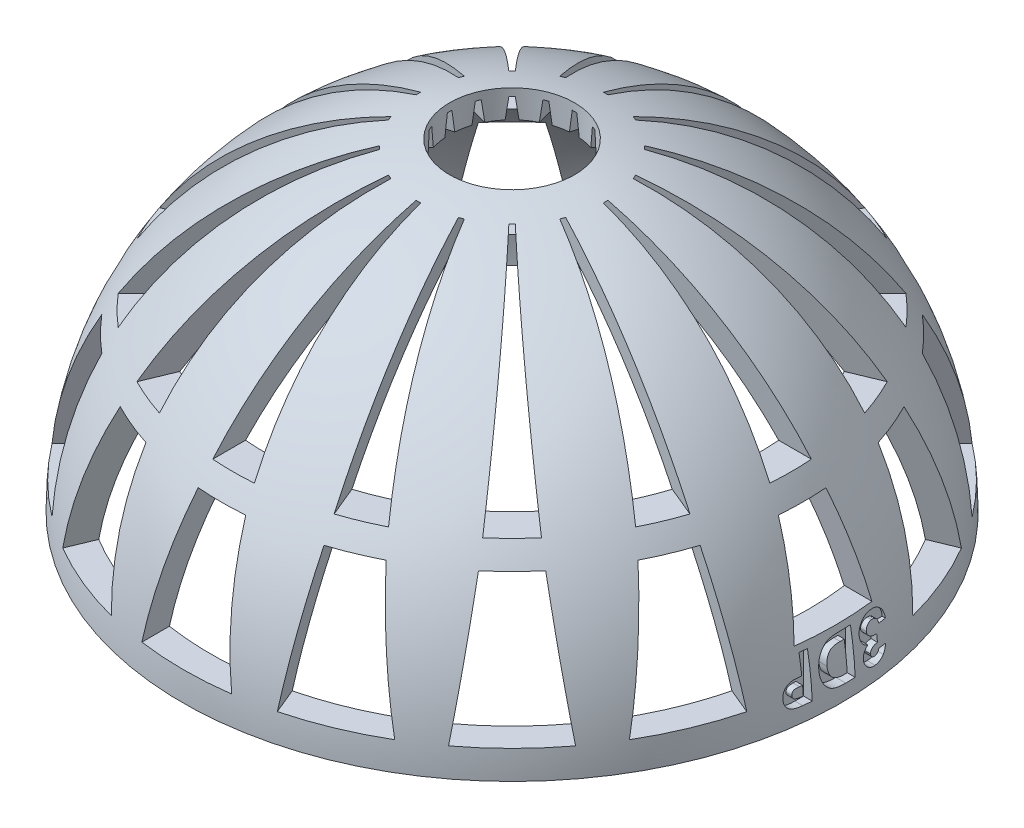
from build123d import *

# Parameters (mm, degrees)
CUT_EXTRUDE1_DEPTH       = 48.5
CIRPATTERN1_COUNT        = 16
SKETCH9_R                = 9.193530205
CUT_EXTRUDE2_DEPTH       = 13.5
REVOLVE3_ANGLE           = 10
REVOLVE3_OTHER_WAY_ANGLE = 10
CUT_EXTRUDE3_DEPTH       = 3.5


with BuildPart() as part:
    # Sketch7 → Revolve2 (revolve)
    with BuildSketch(Plane.XY):
        with BuildLine():
            Line((44.5, 0), (48.5, 0))
            ThreePointArc((48.5, 0), (34.294678888, 34.294678888), (0, 48.5))
            Line((0, 48.5), (0, 44.5))
            ThreePointArc((0, 44.5), (31.466251763, 31.466251763), (44.5, 0))
        make_face()
    revolve(axis=Axis((0, 0, 0), (0, 1, 0)))

    # Sketch8 → Cut-Extrude1 (cut)
    with BuildSketch(Plane(origin=(50.5, 0, 0), x_dir=(0, 0, -1), z_dir=(1, 0, 0))):
        Polygon((-3.5, 22.75), (-6.611443727, 4.095480906), (6.611443727, 4.095480906), (3.5, 22.75), align=None)
        Polygon((-3.060333396, 25.75), (-0.335906804, 46.5), (0.335906804, 46.5), (3.060333396, 25.75), align=None)
    cut_extrude1 = extrude(amount=-CUT_EXTRUDE1_DEPTH, mode=Mode.SUBTRACT)

    # CirPattern1: Cut-Extrude1 ×16 about axis
    cirpattern1_axis = Axis((0, 0, 0), (0, 1, 0))
    for i in range(1, CIRPATTERN1_COUNT):
        add(cut_extrude1.rotate(cirpattern1_axis, i * 360 / CIRPATTERN1_COUNT), mode=Mode.SUBTRACT)

    # Sketch9 → Cut-Extrude2 (cut)
    with BuildSketch(Plane(origin=(0, 43.5, 0), x_dir=(1, 0, 0), z_dir=(0, 1, 0))):
        with Locations(Location((0, 0, 0), (0, 0, 90))):
            Circle(SKETCH9_R)
    extrude(amount=CUT_EXTRUDE2_DEPTH, mode=Mode.SUBTRACT)

    # Sketch11 → Revolve3 (revolve)
    with BuildSketch(Plane.XY):
        with BuildLine():
            Line((48.5, 0), (44.5, 0))
            ThreePointArc((44.5, 0), (44.268328112, 4.734817976), (43.575525721, 9.424401963))
            Line((43.575525721, 9.424401963), (47.575525721, 9.424401963))
            ThreePointArc((47.575525721, 9.424401963), (48.268328112, 4.734817976), (48.5, 0))
        make_face()
    revolve(axis=Axis((0, 0, 0), (0, 1, 0)), revolution_arc=REVOLVE3_ANGLE)

    # Sketch11 → Revolve3 other way (revolve)
    with BuildSketch(Plane.XY):
        with BuildLine():
            Line((48.5, 0), (44.5, 0))
            ThreePointArc((44.5, 0), (44.268328112, 4.734817976), (43.575525721, 9.424401963))
            Line((43.575525721, 9.424401963), (47.575525721, 9.424401963))
            ThreePointArc((47.575525721, 9.424401963), (48.268328112, 4.734817976), (48.5, 0))
        make_face()
    revolve(axis=Axis((0, 0, 0), (0, -1, 0)), revolution_arc=REVOLVE3_OTHER_WAY_ANGLE)

    # Sketch12 → Cut-Extrude3 (cut)
    # profile 1 of 3: a face of its own
    with BuildSketch(Plane(origin=(50.5, 0, 0), x_dir=(0, 0, -1), z_dir=(1, 0, 0))):
        with BuildLine():
            Line((5.991387788, 3.696485389), (7.131131377, 3.696485389))
            add(Edge.make_bspline(
                [(7.131131377, 3.696485389), (7.123134554, 3.639501206), (7.107514777, 3.528196993), (7.069117074, 3.366670745), (7.024712457, 3.213071198), (6.967925233, 3.068222673), (6.902374627, 2.93228132), (6.825933725, 2.805125488), (6.742149433, 2.684930384), (6.67655157, 2.612901178), (6.643941874, 2.577094364)],
                knots=[0, 0, 0, 0, 1.1115466, 2.171125598, 3.205689823, 4.19946166, 5.17440286, 6.118867946, 7.064860634, 8, 8, 8, 8], degree=3))
            add(Edge.make_bspline(
                [(6.643941874, 2.577094364), (6.59702271, 2.529776827), (6.504549967, 2.436518935), (6.350017169, 2.317065877), (6.188038258, 2.213687378), (6.015364675, 2.131728157), (5.834683353, 2.065391662), (5.64455745, 2.020833289), (5.445763891, 1.991268415), (5.310112295, 1.988356172), (5.240886986, 1.986870005)],
                knots=[0, 0, 0, 0, 1.01925491, 2.00884431, 2.983262333, 3.955970413, 4.92937149, 5.924503185, 6.940838805, 8, 8, 8, 8], degree=3))
            add(Edge.make_bspline(
                [(5.240886986, 1.986870005), (5.179342126, 1.988322958), (5.058357331, 1.991179172), (4.880540125, 2.014107308), (4.7110063, 2.054320704), (4.547963834, 2.106898818), (4.39381055, 2.178440128), (4.245144136, 2.261484362), (4.106118337, 2.363341567), (3.976407859, 2.478429958), (3.857244046, 2.602909318), (3.754047662, 2.735967518), (3.665327879, 2.874050265), (3.592234512, 3.018304767), (3.536035646, 3.168975118), (3.497031967, 3.325190918), (3.471503111, 3.486607463), (3.46895977, 3.596320115), (3.467669839, 3.651964155)],
                knots=[0, 0, 0, 0, 1.091422571, 2.145516843, 3.172569842, 4.178562979, 5.178154469, 6.181868002, 7.194278174, 8.227918432, 9.254613415, 10.245994977, 11.209837596, 12.161663635, 13.10878368, 14.055455738, 15.013766427, 16, 16, 16, 16], degree=3))
            add(Edge.make_bspline(
                [(3.467669839, 3.651964155), (3.470367821, 3.720862433), (3.47569559, 3.856917461), (3.517830424, 4.055652316), (3.585564572, 4.245246717), (3.681872492, 4.423454239), (3.802814199, 4.590089244), (3.951126284, 4.739331917), (4.122669944, 4.873493546), (4.251446475, 4.945592926), (4.31738939, 4.982513034)],
                knots=[0, 0, 0, 0, 0.992776698, 1.96045919, 2.915875678, 3.886951799, 4.871409521, 5.874469288, 6.911574252, 8, 8, 8, 8], degree=3))
            add(Edge.make_bspline(
                [(4.31738939, 4.982513034), (4.272125492, 4.997371675), (4.183183963, 5.026568238), (4.056789765, 5.084106055), (3.936504399, 5.146851741), (3.825078751, 5.220100619), (3.719457237, 5.298775631), (3.622981578, 5.387106898), (3.533153569, 5.482827099), (3.452195444, 5.586954515), (3.379815126, 5.697757884), (3.31602706, 5.81324568), (3.262496883, 5.933839991), (3.217569274, 6.058654614), (3.183290752, 6.188917932), (3.15917457, 6.324188499), (3.145230284, 6.464140385), (3.143103964, 6.558958357), (3.142028813, 6.606902056)],
                knots=[0, 0, 0, 0, 1.059375415, 2.081625174, 3.086260357, 4.075579879, 5.045586876, 6.014170127, 6.982201689, 7.963705737, 8.945119069, 9.924852636, 10.896327119, 11.878239286, 12.873838556, 13.889973282, 14.933087432, 16, 16, 16, 16], degree=3))
            add(Edge.make_bspline(
                [(3.142028813, 6.606902056), (3.144021775, 6.67739074), (3.14795316, 6.816439131), (3.177962552, 7.020576241), (3.226162661, 7.216250536), (3.293882515, 7.403708651), (3.382549056, 7.582387624), (3.489640085, 7.753488981), (3.616463975, 7.915668257), (3.761097834, 8.067488581), (3.920373895, 8.206816306), (4.091953433, 8.329794383), (4.275944175, 8.431200401), (4.467957346, 8.517867716), (4.672302618, 8.582190495), (4.886340939, 8.629294395), (5.111634109, 8.657953973), (5.265395039, 8.660970479), (5.343921842, 8.66251103)],
                knots=[0, 0, 0, 0, 1.005301618, 1.9830924, 2.936709333, 3.876255674, 4.820386332, 5.77704884, 6.75110905, 7.752325838, 8.764085485, 9.766124222, 10.757295257, 11.756573224, 12.766631673, 13.80722022, 14.880131728, 16, 16, 16, 16], degree=3))
            add(Edge.make_bspline(
                [(5.343921842, 8.66251103), (5.418208752, 8.660890911), (5.563466975, 8.657722982), (5.775933426, 8.630290025), (5.977878224, 8.586069035), (6.16974431, 8.523629828), (6.350714827, 8.443183724), (6.52184411, 8.346083941), (6.681263953, 8.229355329), (6.829708304, 8.095751945), (6.96591869, 7.947921448), (7.084631366, 7.784658857), (7.187942685, 7.609531604), (7.276534485, 7.422163069), (7.345753175, 7.220881421), (7.400800965, 7.007484184), (7.439125245, 6.781048614), (7.450813207, 6.62526952), (7.456772403, 6.545844364)],
                knots=[0, 0, 0, 0, 1.066693477, 2.085777942, 3.071407889, 4.032495163, 4.978645371, 5.911608997, 6.853298848, 7.810770565, 8.776420673, 9.735131334, 10.704462168, 11.693492242, 12.70668109, 13.756973703, 14.856375978, 16, 16, 16, 16], degree=3))
            Line((7.456772403, 6.545844364), (6.317028813, 6.545844364))
            add(Edge.make_bspline(
                [(6.317028813, 6.545844364), (6.309804969, 6.585780288), (6.295734636, 6.663565974), (6.268316131, 6.776193429), (6.232492021, 6.880114616), (6.191534434, 6.976093018), (6.146251013, 7.065113632), (6.092145176, 7.144795887), (6.034131714, 7.218271302), (5.946924263, 7.302726341), (5.82524989, 7.391295309), (5.660509943, 7.469736043), (5.476416357, 7.514348242), (5.347977698, 7.519898632), (5.281592115, 7.522767441)],
                knots=[0, 0, 0, 0, 0.928450228, 1.808400301, 2.64896863, 3.43999153, 4.194978884, 4.9294959, 5.640047715, 6.332896648, 7.70085756, 9.063442004, 10.482192841, 12, 12, 12, 12], degree=3))
            add(Edge.make_bspline(
                [(5.281592115, 7.522767441), (5.246360159, 7.522161177), (5.17734864, 7.520973643), (5.075964348, 7.507885844), (4.979445192, 7.486174836), (4.886782965, 7.457032736), (4.799241561, 7.418603534), (4.715701814, 7.372903585), (4.637650191, 7.317347073), (4.564840835, 7.25469914), (4.498947754, 7.185712761), (4.439351085, 7.113651934), (4.391518918, 7.035572193), (4.35181432, 6.95456136), (4.319062803, 6.870640366), (4.298514576, 6.781899761), (4.28313047, 6.690118202), (4.282229609, 6.627323399), (4.281772403, 6.595453739)],
                knots=[0, 0, 0, 0, 1.110416125, 2.175056767, 3.216269732, 4.226816172, 5.232753079, 6.226173397, 7.223992381, 8.247806573, 9.250094092, 10.229378924, 11.190237183, 12.128982156, 13.072570213, 14.022671385, 14.996464856, 16, 16, 16, 16], degree=3))
            add(Edge.make_bspline(
                [(4.281772403, 6.595453739), (4.282933286, 6.560586981), (4.285230452, 6.491592312), (4.305445403, 6.390483929), (4.335704203, 6.292849186), (4.379221974, 6.199493644), (4.436166913, 6.110966337), (4.505406121, 6.026534079), (4.58756595, 5.946869088), (4.679895091, 5.869651199), (4.786118861, 5.802055025), (4.901947779, 5.739809056), (5.030235385, 5.690245923), (5.167904042, 5.645987678), (5.317542245, 5.613659444), (5.478225309, 5.59018678), (5.649692712, 5.572714786), (5.767887477, 5.570208159), (5.828567275, 5.568921287)],
                knots=[0, 0, 0, 0, 0.809868251, 1.602574917, 2.388262527, 3.182133002, 3.988875265, 4.829537611, 5.714850619, 6.646378958, 7.622533229, 8.636771727, 9.698525113, 10.814716514, 11.996253919, 13.252421425, 14.589425562, 16, 16, 16, 16], degree=3))
            Line((5.828567275, 5.568921287), (5.828567275, 4.510587954))
            add(Edge.make_bspline(
                [(5.828567275, 4.510587954), (5.753009742, 4.504172017), (5.61165656, 4.492169071), (5.415561777, 4.463801914), (5.249597659, 4.426713114), (5.111980181, 4.379202344), (4.995999516, 4.323445784), (4.897260687, 4.257295853), (4.809358546, 4.184050305), (4.737592727, 4.09992006), (4.679599325, 4.011111401), (4.638535731, 3.917868897), (4.611277243, 3.822265403), (4.608693618, 3.756872444), (4.607413429, 3.724470165)],
                knots=[0, 0, 0, 0, 1.700278244, 3.18088388, 4.44026007, 5.507838349, 6.439172496, 7.317391478, 8.167251366, 8.996486918, 9.787781501, 10.536992524, 11.275078289, 12, 12, 12, 12], degree=3))
            add(Edge.make_bspline(
                [(4.607413429, 3.724470165), (4.60957118, 3.683101978), (4.613782652, 3.602360035), (4.648011384, 3.487086394), (4.703623422, 3.382625441), (4.781923708, 3.292578459), (4.877725881, 3.218230697), (4.989330996, 3.164041002), (5.114846814, 3.131627296), (5.202952607, 3.128322678), (5.248519198, 3.126613595)],
                knots=[0, 0, 0, 0, 1.008776249, 1.968917671, 2.909425455, 3.878736958, 4.86052431, 5.85160606, 6.888892716, 8, 8, 8, 8], degree=3))
            add(Edge.make_bspline(
                [(5.248519198, 3.126613595), (5.289818177, 3.128641753), (5.371768, 3.13266624), (5.491554797, 3.162837634), (5.605181306, 3.213113993), (5.70973348, 3.283716274), (5.804954185, 3.367635647), (5.884794811, 3.466220795), (5.949790021, 3.575615698), (5.977467507, 3.656037545), (5.991387788, 3.696485389)],
                knots=[0, 0, 0, 0, 0.988439209, 1.961366134, 2.938893463, 3.950078543, 4.971412263, 5.967491143, 6.977757845, 8, 8, 8, 8], degree=3))
        make_face()
    # profile 2 of 3: a face of its own
    with BuildSketch(Plane(origin=(50.5, 0, 0), x_dir=(0, 0, -1), z_dir=(1, 0, 0))):
        with BuildLine():
            Line((2.08369548, 2.149690518), (0.647567676, 2.149690518))
            add(Edge.make_bspline(
                [(0.647567676, 2.149690518), (0.535602268, 2.150455111), (0.31917187, 2.151933078), (0.005651367, 2.169222741), (-0.28610081, 2.194611832), (-0.555424673, 2.233468692), (-0.803290073, 2.278568155), (-1.027867381, 2.338965916), (-1.230984297, 2.408277545), (-1.414772525, 2.489035157), (-1.582095037, 2.583745141), (-1.739846647, 2.690147879), (-1.889848513, 2.809839663), (-2.032931915, 2.943099122), (-2.16944555, 3.089040217), (-2.296184875, 3.250601593), (-2.417213062, 3.423598598), (-2.530566416, 3.608631658), (-2.631465058, 3.805335474), (-2.721276162, 4.010614068), (-2.796105033, 4.224600859), (-2.857033356, 4.447000384), (-2.905566133, 4.677168406), (-2.939532126, 4.91554348), (-2.960528071, 5.161912071), (-2.962658093, 5.328887891), (-2.963740417, 5.413732986)],
                knots=[0, 0, 0, 0, 1.44349102, 2.790284463, 4.047513061, 5.218094321, 6.297837468, 7.293772999, 8.213586047, 9.062895527, 9.878013142, 10.689252941, 11.514048747, 12.349645483, 13.208421871, 14.087867281, 14.994836234, 15.929653487, 16.883274053, 17.843080533, 18.816554169, 19.803369425, 20.81449504, 21.847452076, 22.906230055, 24, 24, 24, 24], degree=3))
            add(Edge.make_bspline(
                [(-2.963740417, 5.413732986), (-2.960906595, 5.533455095), (-2.955328051, 5.769135074), (-2.908332428, 6.114990594), (-2.832336988, 6.446535801), (-2.725437239, 6.761138946), (-2.593060307, 7.056136109), (-2.434522589, 7.325617985), (-2.254378175, 7.570133881), (-2.051028494, 7.785626774), (-1.831198068, 7.971979855), (-1.601855119, 8.129718482), (-1.363204827, 8.256332478), (-1.152477635, 8.335399577), (-0.969236214, 8.385093574), (-0.808590214, 8.413962459), (-0.625761175, 8.440737168), (-0.420060025, 8.463750737), (-0.190876769, 8.479510486), (0.061078901, 8.490393704), (0.335868009, 8.498480628), (0.526717811, 8.499276654), (0.625943076, 8.499690518)],
                knots=[0, 0, 0, 0, 1.315347898, 2.589339334, 3.828278609, 5.048487211, 6.235212834, 7.375728391, 8.47833097, 9.56625089, 10.624194351, 11.640157642, 12.619895326, 13.585848527, 14.106971868, 14.704705962, 15.37825295, 16.137840974, 16.978850452, 17.902510282, 18.909488129, 20, 20, 20, 20], degree=3))
            Line((0.625943076, 8.499690518), (2.08369548, 8.499690518))
            Line((2.08369548, 8.499690518), (2.08369548, 2.149690518))
        make_face()
        with BuildLine():
            Line((0.94395189, 3.289434107), (0.94395189, 7.359946928))
            Line((0.94395189, 7.359946928), (0.34863939, 7.359946928))
            add(Edge.make_bspline(
                [(0.34863939, 7.359946928), (0.277818626, 7.359603985), (0.141627347, 7.358944491), (-0.055242263, 7.349883127), (-0.236926137, 7.335168548), (-0.403662256, 7.31340347), (-0.555833934, 7.287214509), (-0.69288609, 7.254822217), (-0.815088853, 7.215430723), (-0.923449957, 7.169007449), (-1.022381253, 7.116004983), (-1.114033096, 7.054114445), (-1.202488306, 6.985334432), (-1.286111981, 6.907704318), (-1.365215717, 6.822235182), (-1.43933174, 6.728491054), (-1.509453548, 6.62675777), (-1.573763207, 6.516493402), (-1.632585181, 6.398879371), (-1.684552869, 6.274988572), (-1.728423112, 6.144145607), (-1.761738288, 6.006408394), (-1.790118427, 5.862631652), (-1.810611065, 5.711890941), (-1.821775524, 5.55467874), (-1.823249174, 5.447670762), (-1.823996828, 5.393380421)],
                knots=[0, 0, 0, 0, 1.502729547, 2.8898115, 4.181010027, 5.369596896, 6.45687185, 7.456390247, 8.355533714, 9.177830239, 9.954819978, 10.733423081, 11.521791071, 12.330436719, 13.151797389, 13.990712567, 14.864234656, 15.771624029, 16.697123225, 17.652960569, 18.620374037, 19.622036587, 20.657870943, 21.729319508, 22.8479736, 24, 24, 24, 24], degree=3))
            add(Edge.make_bspline(
                [(-1.823996828, 5.393380421), (-1.822483482, 5.310188385), (-1.819532574, 5.147970361), (-1.790896767, 4.911727813), (-1.744756127, 4.689548503), (-1.677541967, 4.482003189), (-1.594886126, 4.287772413), (-1.489787497, 4.109359081), (-1.368630834, 3.943838808), (-1.272768056, 3.846757105), (-1.224868222, 3.79824821)],
                knots=[0, 0, 0, 0, 1.138242922, 2.219485503, 3.251901297, 4.239342788, 5.201071, 6.134757343, 7.067992642, 8, 8, 8, 8], degree=3))
            add(Edge.make_bspline(
                [(-1.224868222, 3.79824821), (-1.177638384, 3.756910671), (-1.081176788, 3.672483428), (-0.911821924, 3.571318), (-0.725201635, 3.482434256), (-0.517046608, 3.411959359), (-0.28936857, 3.356224807), (-0.040811464, 3.317786048), (0.227293631, 3.29308571), (0.413030594, 3.290677386), (0.508915833, 3.289434107)],
                knots=[0, 0, 0, 0, 0.813307809, 1.661089106, 2.549956539, 3.493439533, 4.508053171, 5.589449661, 6.755572447, 8, 8, 8, 8], degree=3))
            Line((0.508915833, 3.289434107), (0.94395189, 3.289434107))
        make_face(mode=Mode.SUBTRACT)
    # profile 3 of 3: a face of its own
    with BuildSketch(Plane(origin=(50.5, 0, 0), x_dir=(0, 0, -1), z_dir=(1, 0, 0))):
        with BuildLine():
            Line((-4.103484007, 2.149690518), (-5.375519264, 2.149690518))
            add(Edge.make_bspline(
                [(-5.375519264, 2.149690518), (-5.458632398, 2.150062549), (-5.618975055, 2.150780276), (-5.85020235, 2.159483689), (-6.06352088, 2.175080692), (-6.258881508, 2.194356252), (-6.436204326, 2.221379397), (-6.595710037, 2.252360655), (-6.737436099, 2.290100486), (-6.862966681, 2.334911027), (-6.97566107, 2.387694694), (-7.082181003, 2.444073495), (-7.180923284, 2.510901835), (-7.274206099, 2.583362596), (-7.36132381, 2.662963261), (-7.442921978, 2.74938923), (-7.518160367, 2.843896523), (-7.586567281, 2.945834072), (-7.648656986, 3.053126498), (-7.702893682, 3.166018474), (-7.746889754, 3.284674263), (-7.783796342, 3.408330183), (-7.813440245, 3.536979777), (-7.833172129, 3.671414547), (-7.846575029, 3.810695737), (-7.84775765, 3.905490606), (-7.848355802, 3.953436511)],
                knots=[0, 0, 0, 0, 1.698787518, 3.27731721, 4.728409951, 6.070286353, 7.288646904, 8.393455548, 9.389990496, 10.283725379, 11.113616976, 11.931887102, 12.744353494, 13.547053751, 14.344590688, 15.153907614, 15.974148981, 16.810666655, 17.660988447, 18.506082349, 19.367288142, 20.244738011, 21.142497992, 22.06302001, 23.020302899, 24, 24, 24, 24], degree=3))
            add(Edge.make_bspline(
                [(-7.848355802, 3.953436511), (-7.847494102, 4.00647946), (-7.845800754, 4.110715374), (-7.829075078, 4.263486244), (-7.800784519, 4.409238575), (-7.762911382, 4.548595023), (-7.713511154, 4.681250717), (-7.651596134, 4.806334215), (-7.580773832, 4.925412905), (-7.497165288, 5.036308827), (-7.404777581, 5.139586489), (-7.305297137, 5.236369813), (-7.195739001, 5.322680825), (-7.08001364, 5.403006727), (-6.954809829, 5.472632721), (-6.823837115, 5.537103488), (-6.683773658, 5.591812839), (-6.586304112, 5.620515161), (-6.536887453, 5.63506712)],
                knots=[0, 0, 0, 0, 1.101767505, 2.165108537, 3.187936629, 4.183892551, 5.162396277, 6.123736501, 7.080098904, 8.036826416, 9.0040019, 9.957275584, 10.916231297, 11.898534744, 12.880877694, 13.889532316, 14.930001539, 16, 16, 16, 16], degree=3))
            add(Edge.make_bspline(
                [(-6.536887453, 5.63506712), (-6.504335138, 5.643166189), (-6.433816341, 5.66071138), (-6.317127101, 5.678524152), (-6.182655004, 5.694901901), (-6.029965213, 5.708976594), (-5.858969699, 5.718544105), (-5.669834031, 5.726015906), (-5.462472495, 5.731448677), (-5.318281483, 5.731641455), (-5.243227597, 5.7317418)],
                knots=[0, 0, 0, 0, 0.618981996, 1.340914327, 2.176866532, 3.120127938, 4.170906482, 5.338178032, 6.614476169, 8, 8, 8, 8], degree=3))
            Line((-5.243227597, 5.7317418), (-5.243227597, 8.499690518))
            Line((-5.243227597, 8.499690518), (-4.103484007, 8.499690518))
            Line((-4.103484007, 8.499690518), (-4.103484007, 2.149690518))
        make_face()
        with BuildLine():
            Line((-5.243227597, 4.59199821), (-5.646462773, 4.59199821))
            add(Edge.make_bspline(
                [(-5.646462773, 4.59199821), (-5.719838979, 4.591534687), (-5.854852288, 4.590681799), (-6.039216133, 4.578282751), (-6.187423057, 4.559431334), (-6.304380706, 4.532173347), (-6.396765477, 4.491586134), (-6.475486868, 4.442633746), (-6.545425905, 4.383808577), (-6.603725586, 4.313286363), (-6.651234194, 4.234606019), (-6.684556173, 4.147173437), (-6.705587577, 4.052385883), (-6.707585008, 3.986200927), (-6.708612212, 3.952164476)],
                knots=[0, 0, 0, 0, 1.862351722, 3.426754836, 4.68713255, 5.653025869, 6.462861518, 7.236406327, 7.999926698, 8.771672214, 9.54880311, 10.322347919, 11.137246204, 12, 12, 12, 12], degree=3))
            add(Edge.make_bspline(
                [(-6.708612212, 3.952164476), (-6.70761704, 3.922419836), (-6.705686168, 3.864708084), (-6.691305961, 3.781474293), (-6.668987147, 3.704035409), (-6.63487717, 3.633470908), (-6.59346455, 3.568134937), (-6.54092749, 3.510061421), (-6.480341463, 3.457371485), (-6.433487794, 3.429516991), (-6.409683927, 3.415365598)],
                knots=[0, 0, 0, 0, 1.102449765, 2.139017612, 3.12397484, 4.080535277, 5.035673127, 5.982361139, 6.974944601, 8, 8, 8, 8], degree=3))
            add(Edge.make_bspline(
                [(-6.409683927, 3.415365598), (-6.389525773, 3.405171041), (-6.34684683, 3.383587076), (-6.274160453, 3.358494139), (-6.190281484, 3.337325481), (-6.094643645, 3.3197557), (-5.987628463, 3.306119726), (-5.869255032, 3.295691616), (-5.739349153, 3.291498067), (-5.649007387, 3.29014107), (-5.601941539, 3.289434107)],
                knots=[0, 0, 0, 0, 0.656809284, 1.390599849, 2.23162475, 3.173112763, 4.218524733, 5.370385145, 6.63003504, 8, 8, 8, 8], degree=3))
            Line((-5.601941539, 3.289434107), (-5.243227597, 3.289434107))
            Line((-5.243227597, 3.289434107), (-5.243227597, 4.59199821))
        make_face(mode=Mode.SUBTRACT)
    extrude(amount=-CUT_EXTRUDE3_DEPTH, mode=Mode.SUBTRACT)


solid = part.part
